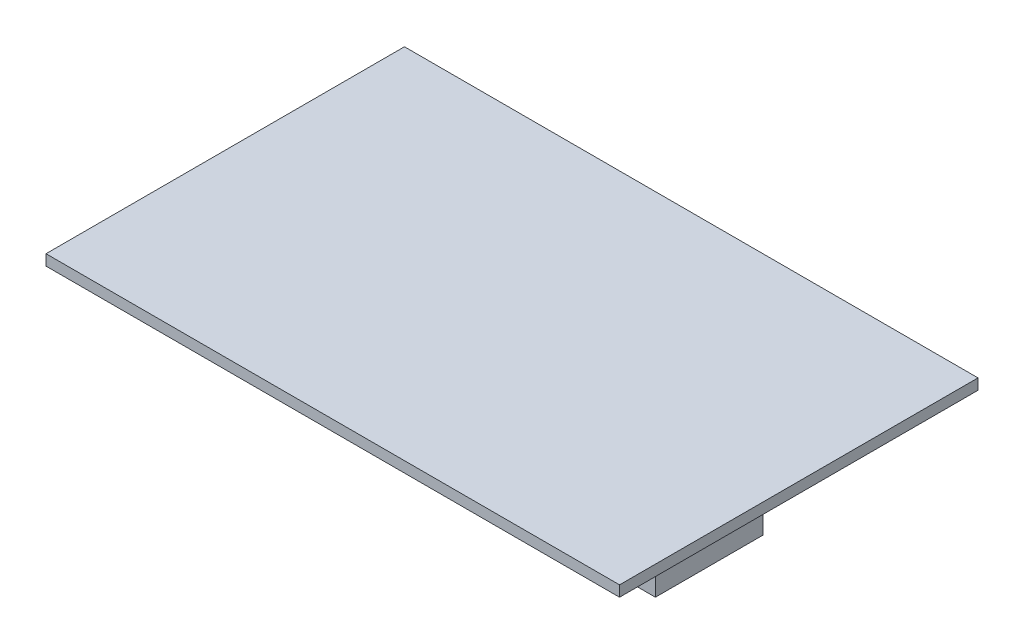
from build123d import *

# Parameters (mm, degrees)
SKETCH1_W           = 160
SKETCH1_H           = 100
BOSS_EXTRUDE1_DEPTH = 3
SKETCH2_W           = 10
SKETCH2_H           = 30
BOSS_EXTRUDE2_DEPTH = 30
SKETCH3_R           = 18
BOSS_EXTRUDE3_DEPTH = 80


with BuildPart() as part:
    # Sketch1 → Boss-Extrude1 (new body)
    with BuildSketch(Plane(origin=(0, 0, 0), x_dir=(1, 0, 0), z_dir=(0, 1, 0))):
        Rectangle(SKETCH1_W, SKETCH1_H)
    extrude(amount=BOSS_EXTRUDE1_DEPTH)

    # Sketch2 → Boss-Extrude2 (add)
    with BuildSketch(Plane(origin=(0, 0, 0), x_dir=(1, 0, 0), z_dir=(0, 1, 0))):
        with Locations((50, 0)):
            Rectangle(SKETCH2_W, SKETCH2_H)
    extrude(amount=-BOSS_EXTRUDE2_DEPTH)

    # Sketch3 → Boss-Extrude3 (add)
    with BuildSketch(Plane.ZY.offset(-45)):
        with Locations(Location((0, -20, 0), (0, 0, 146.442690238))):
            Circle(SKETCH3_R)
    extrude(amount=BOSS_EXTRUDE3_DEPTH)


solid = part.part
